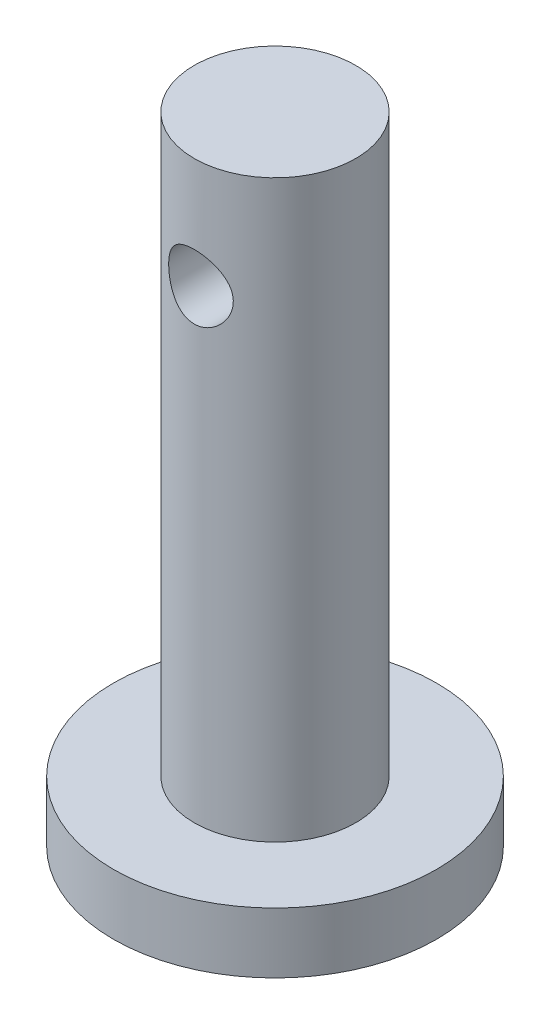
from build123d import *

# Parameters (mm, degrees)
ESQUISSE1_R                  = 8
ESQUISSE1_R_2                = 4
BOSS_EXTRU_1_DEPTH           = 3
ESQUISSE1_4_R                = 4
BOSS_EXTRU_3_DEPTH           = 31.5
ENL_V_MAT_EXTRU_1_DEPTH      = 10
ENL_V_MAT_EXTRU_1_DEPTH_BACK = 10
ESQUISSE2_R                  = 1.6


with BuildPart() as part:
    # Esquisse1 → Boss.-Extru.1 (new body)
    with BuildSketch(Plane(origin=(0, 0, 0), x_dir=(1, 0, 0), z_dir=(0, 1, 0))):
        Circle(ESQUISSE1_R)
        Circle(ESQUISSE1_R_2, mode=Mode.SUBTRACT)
    extrude(amount=BOSS_EXTRU_1_DEPTH)

    # Esquisse1<4> → Boss.-Extru.3 (add)
    with BuildSketch(Plane(origin=(0, 0, 0), x_dir=(1, 0, 0), z_dir=(0, 1, 0))):
        Circle(ESQUISSE1_4_R)
    extrude(amount=BOSS_EXTRU_3_DEPTH)

    # Esquisse2 → Enlèv. mat.-Extru.1 (cut, two sides: drawn at the far end of the back side and taken through both)
    with BuildSketch(Plane.XY.offset(-ENL_V_MAT_EXTRU_1_DEPTH_BACK)):
        with Locations((0, 26)):
            Circle(ESQUISSE2_R)
    extrude(amount=ENL_V_MAT_EXTRU_1_DEPTH + ENL_V_MAT_EXTRU_1_DEPTH_BACK, mode=Mode.SUBTRACT)


solid = part.part
